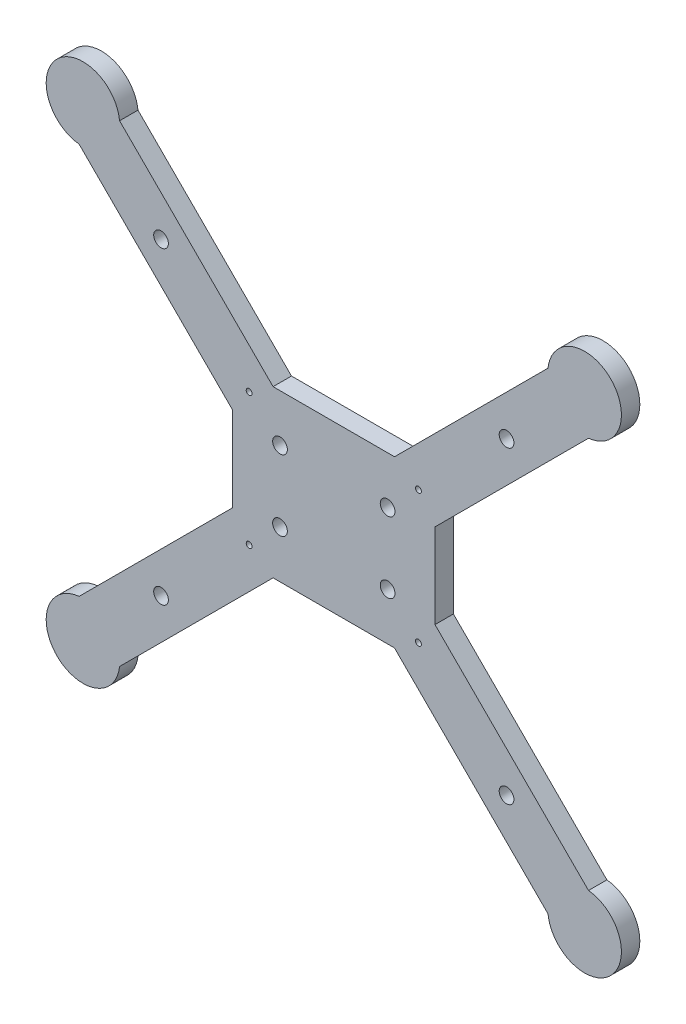
from build123d import *

# Parameters (mm, degrees)
ESQUISSE1_W             = 110
ESQUISSE1_H             = 90
BOSS_EXTRU_1_DEPTH      = 10
ESQUISSE3_R             = 4
ESQUISSE3_R_2           = 1.6
ENL_V_MAT_EXTRU_2_DEPTH = 215.345138396


with BuildPart() as part:
    # Esquisse1 → Boss.-Extru.1 (new body)
    with BuildSketch(Plane.XY):
        with BuildLine():
            ThreePointArc((-116.429085419, 128.429085419), (-150.45941546, 140.45941546), (-138.429085419, 106.429085419))
            Line((-138.429085419, 106.429085419), (-147.317279836, 115.317279836))
            Line((-147.317279836, 115.317279836), (-125.317279836, 137.317279836))
            Line((-125.317279836, 137.317279836), (-116.429085419, 128.429085419))
        make_face()
        with BuildLine():
            Line((-147.317279836, 115.317279836), (-138.429085419, 106.429085419))
            ThreePointArc((-138.429085419, 106.429085419), (-122.942604357, 111.447240972), (-116.317279836, 126.317279836))
            ThreePointArc((-116.317279836, 126.317279836), (-116.345250791, 127.374661426), (-116.429085419, 128.429085419))
            Line((-116.429085419, 128.429085419), (-125.317279836, 137.317279836))
            Line((-125.317279836, 137.317279836), (-147.317279836, 115.317279836))
        make_face()
        with BuildLine():
            Line((-138.429085419, 106.429085419), (-55, 23))
            Line((-55, 23), (-55, 45))
            Line((-55, 45), (-33, 45))
            Line((-33, 45), (-116.429085419, 128.429085419))
            ThreePointArc((-116.429085419, 128.429085419), (-116.345250791, 127.374661426), (-116.317279836, 126.317279836))
            ThreePointArc((-116.317279836, 126.317279836), (-122.942604357, 111.447240972), (-138.429085419, 106.429085419))
        make_face()
        with BuildLine():
            Line((116.429085419, 128.429085419), (33, 45))
            Line((33, 45), (55, 45))
            Line((55, 45), (55, 23))
            Line((55, 23), (138.429085419, 106.429085419))
            ThreePointArc((138.429085419, 106.429085419), (122.175144213, 112.175144213), (116.429085419, 128.429085419))
        make_face()
        with BuildLine():
            ThreePointArc((156.317279836, 126.317279836), (137.374661426, 146.289308881), (116.429085419, 128.429085419))
            Line((116.429085419, 128.429085419), (125.317279836, 137.317279836))
            Line((125.317279836, 137.317279836), (147.317279836, 115.317279836))
            Line((147.317279836, 115.317279836), (138.429085419, 106.429085419))
            ThreePointArc((138.429085419, 106.429085419), (151.187318701, 112.942604357), (156.317279836, 126.317279836))
        make_face()
        with BuildLine():
            Line((125.317279836, 137.317279836), (116.429085419, 128.429085419))
            ThreePointArc((116.429085419, 128.429085419), (122.175144213, 112.175144213), (138.429085419, 106.429085419))
            Line((138.429085419, 106.429085419), (147.317279836, 115.317279836))
            Line((147.317279836, 115.317279836), (125.317279836, 137.317279836))
        make_face()
        Rectangle(ESQUISSE1_W, ESQUISSE1_H)
        with BuildLine():
            ThreePointArc((138.429085419, -106.429085419), (122.175144213, -112.175144213), (116.429085419, -128.429085419))
            Line((116.429085419, -128.429085419), (125.317279836, -137.317279836))
            Line((125.317279836, -137.317279836), (147.317279836, -115.317279836))
            Line((147.317279836, -115.317279836), (138.429085419, -106.429085419))
        make_face()
        with BuildLine():
            Line((125.317279836, -137.317279836), (116.429085419, -128.429085419))
            ThreePointArc((116.429085419, -128.429085419), (137.374661426, -146.289308881), (156.317279836, -126.317279836))
            ThreePointArc((156.317279836, -126.317279836), (151.187318701, -112.942604357), (138.429085419, -106.429085419))
            Line((138.429085419, -106.429085419), (147.317279836, -115.317279836))
            Line((147.317279836, -115.317279836), (125.317279836, -137.317279836))
        make_face()
        with BuildLine():
            Line((55, -45), (33, -45))
            Line((33, -45), (116.429085419, -128.429085419))
            ThreePointArc((116.429085419, -128.429085419), (122.175144213, -112.175144213), (138.429085419, -106.429085419))
            Line((138.429085419, -106.429085419), (55, -23))
            Line((55, -23), (55, -45))
        make_face()
        with BuildLine():
            ThreePointArc((-116.317279836, -126.317279836), (-122.942604357, -111.447240972), (-138.429085419, -106.429085419))
            Line((-138.429085419, -106.429085419), (-147.317279836, -115.317279836))
            Line((-147.317279836, -115.317279836), (-125.317279836, -137.317279836))
            Line((-125.317279836, -137.317279836), (-116.429085419, -128.429085419))
            ThreePointArc((-116.429085419, -128.429085419), (-116.345250791, -127.374661426), (-116.317279836, -126.317279836))
        make_face()
        with BuildLine():
            Line((-147.317279836, -115.317279836), (-138.429085419, -106.429085419))
            ThreePointArc((-138.429085419, -106.429085419), (-150.45941546, -140.45941546), (-116.429085419, -128.429085419))
            Line((-116.429085419, -128.429085419), (-125.317279836, -137.317279836))
            Line((-125.317279836, -137.317279836), (-147.317279836, -115.317279836))
        make_face()
        with BuildLine():
            Line((-55, -45), (-55, -23))
            Line((-55, -23), (-138.429085419, -106.429085419))
            ThreePointArc((-138.429085419, -106.429085419), (-122.942604357, -111.447240972), (-116.317279836, -126.317279836))
            ThreePointArc((-116.317279836, -126.317279836), (-116.345250791, -127.374661426), (-116.429085419, -128.429085419))
            Line((-116.429085419, -128.429085419), (-33, -45))
            Line((-33, -45), (-55, -45))
        make_face()
    extrude(amount=BOSS_EXTRU_1_DEPTH)

    # Esquisse3 → Enlèv. mat.-Extru.2 (cut, through all)
    with BuildSketch(Plane(origin=(0, 0, 0), x_dir=(-1, 0, 0), z_dir=(0, 0, -1))):
        with Locations(Location((93.890872965, 83.890872965, 0), (0, 0, 180))):
            Circle(ESQUISSE3_R)
        with Locations((-93.890872965, 83.890872965)):
            Circle(ESQUISSE3_R)
        with Locations((-29.238399287, 19.238399287)):
            Circle(ESQUISSE3_R)
        with Locations((-46, 36)):
            Circle(ESQUISSE3_R_2)
        with Locations((46, 36)):
            Circle(ESQUISSE3_R_2)
        with Locations((46, -36)):
            Circle(ESQUISSE3_R_2)
        with Locations((-46, -36)):
            Circle(ESQUISSE3_R_2)
        with Locations(Location((29.238399287, 19.238399287, 0), (0, 0, 180))):
            Circle(ESQUISSE3_R)
        with Locations(Location((-93.890872965, -83.890872965, 0), (0, 0, 180))):
            Circle(ESQUISSE3_R)
        with Locations(Location((-29.238399287, -19.238399287, 0), (0, 0, 180))):
            Circle(ESQUISSE3_R)
        with Locations((29.238399287, -19.238399287)):
            Circle(ESQUISSE3_R)
        with Locations((93.890872965, -83.890872965)):
            Circle(ESQUISSE3_R)
    extrude(amount=-ENL_V_MAT_EXTRU_2_DEPTH, mode=Mode.SUBTRACT)


solid = part.part
